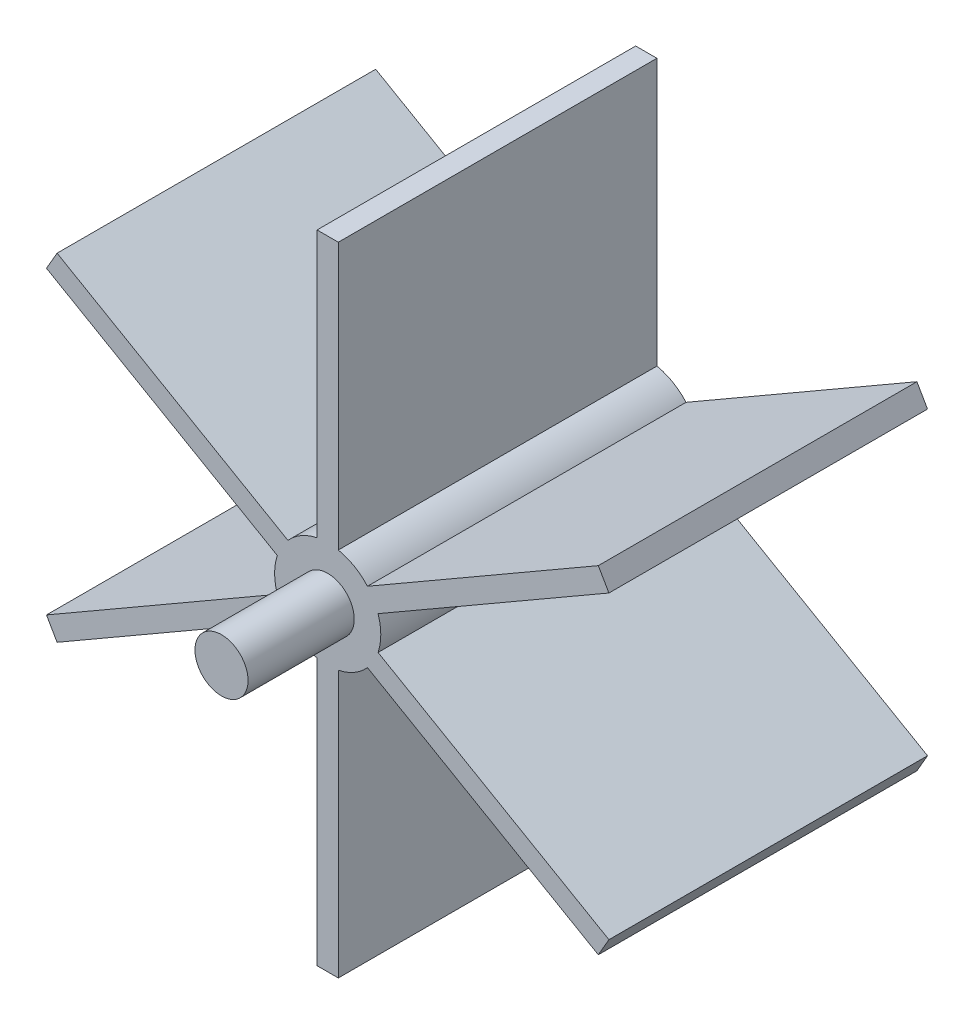
from build123d import *

# Parameters (mm, degrees)
SKETCH1_R           = 12.7
BOSS_EXTRUDE1_DEPTH = 76.2
SKETCH2_R           = 6.35
BOSS_EXTRUDE2_DEPTH = 25.4


with BuildPart() as part:
    # Sketch1 → Boss-Extrude1 (new body)
    with BuildSketch(Plane.XY):
        Circle(SKETCH1_R)
        Polygon((2.54, 0), (2.54, 76.2), (-2.54, 76.2), (-2.54, 0), (-2.54, -76.2), (2.54, -76.2), align=None)
        Polygon((1.27, -2.199704526), (67.261135768, 35.900295474), (64.721135768, 40.299704526), (-1.27, 2.199704526), (-67.261135768, -35.900295474), (-64.721135768, -40.299704526), align=None)
        Polygon((-1.27, -2.199704526), (64.721135768, -40.299704526), (67.261135768, -35.900295474), (1.27, 2.199704526), (-64.721135768, 40.299704526), (-67.261135768, 35.900295474), align=None)
    extrude(amount=BOSS_EXTRUDE1_DEPTH)

    # Sketch2 → Boss-Extrude2 (add)
    with BuildSketch(Plane.XY.offset(76.2)):
        Circle(SKETCH2_R)
    extrude(amount=BOSS_EXTRUDE2_DEPTH)


solid = part.part
